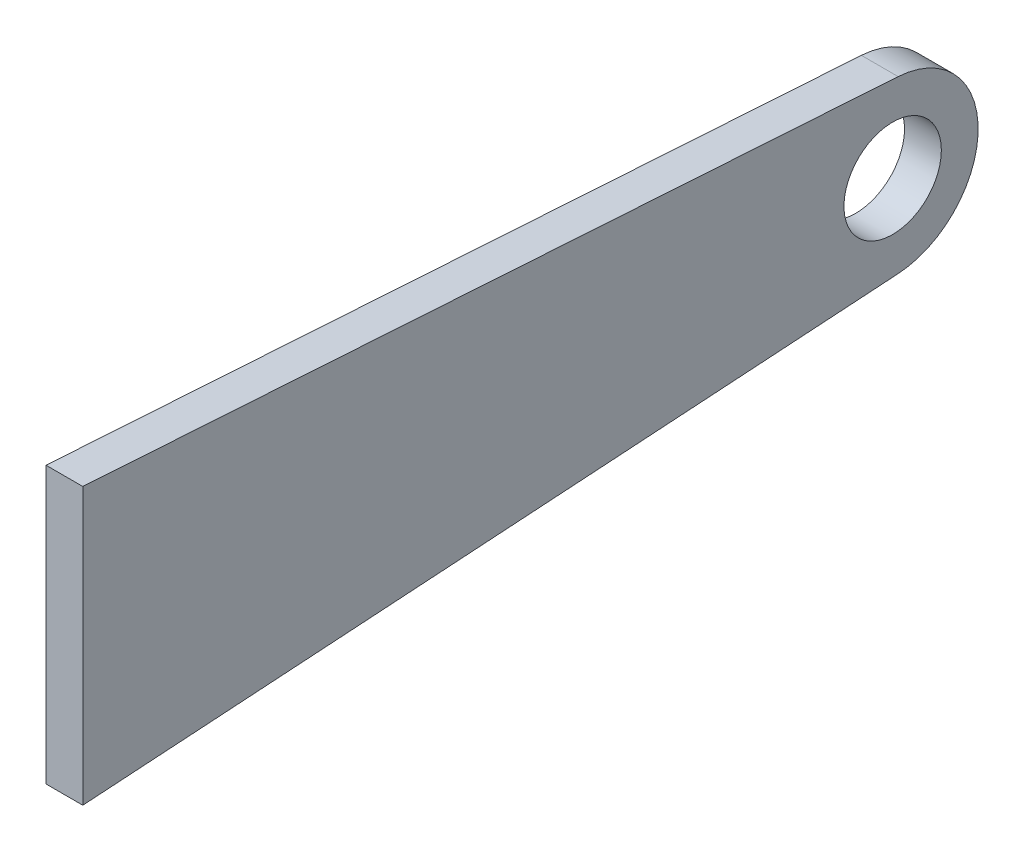
from build123d import *

# Parameters (mm, degrees)
SKETCH1_R           = 4.2
BOSS_EXTRUDE1_DEPTH = 1.5875


with BuildPart() as part:
    # Sketch1 → Boss-Extrude1 (new, symmetric)
    with BuildSketch(Plane(origin=(0, 0, 0), x_dir=(0, 0, -1), z_dir=(1, 0, 0))):
        with BuildLine():
            Line((-69.85, 11.90625), (-69.85, -11.90625))
            Line((-69.85, -11.90625), (0.475805791, -7.359635443))
            ThreePointArc((0.475805791, -7.359635443), (7.375, 0), (0.475805791, 7.359635443))
            Line((0.475805791, 7.359635443), (-69.85, 11.90625))
        make_face()
        Circle(SKETCH1_R, mode=Mode.SUBTRACT)
    extrude(amount=BOSS_EXTRUDE1_DEPTH, both=True)


solid = part.part
